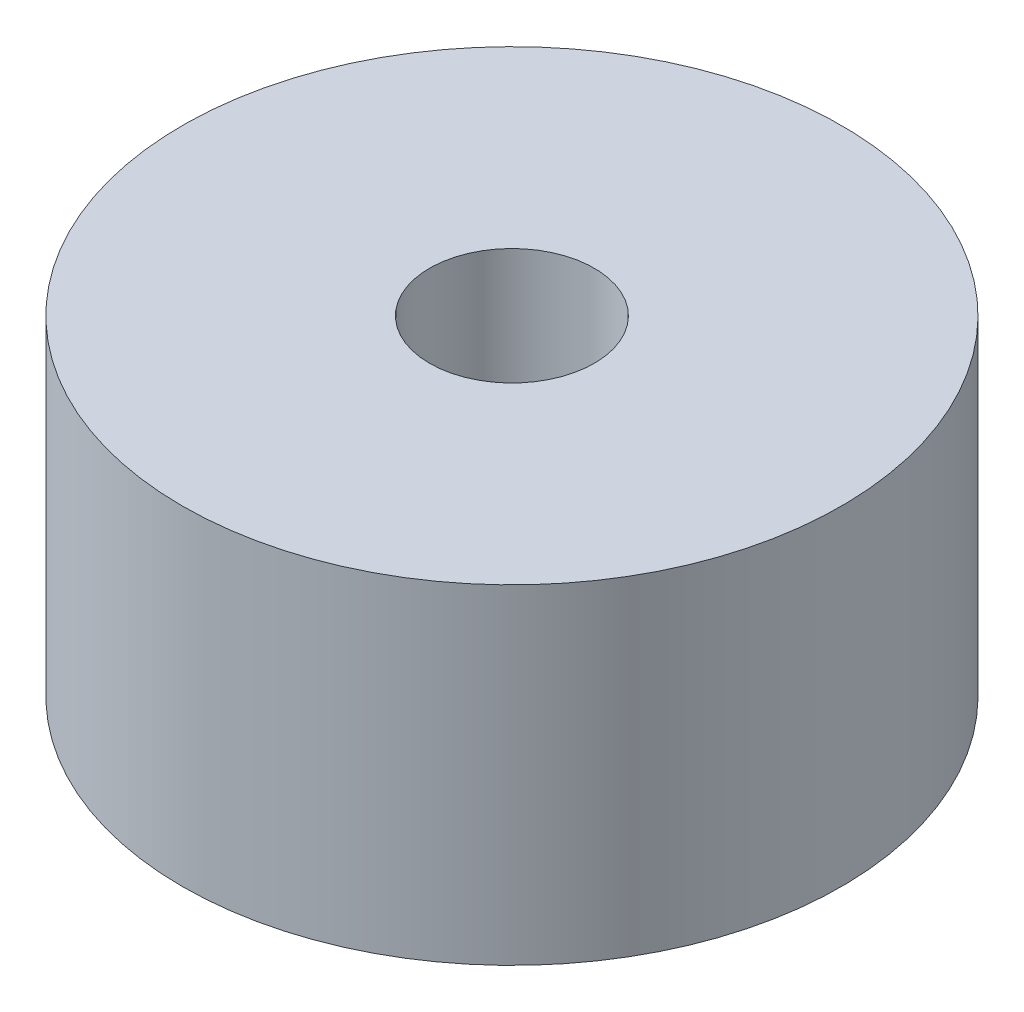
from build123d import *

# Parameters (mm, degrees)
SKETCH1_R           = 50.8
BOSS_EXTRUDE1_DEPTH = 50.8
SKETCH3_R           = 3.175
CUT_EXTRUDE1_DEPTH  = 6.35
CIRPATTERN1_COUNT   = 4
CUT_EXTRUDE2_DEPTH  = 6.35
CUT_EXTRUDE3_START  = 2.54
CUT_EXTRUDE3_DEPTH  = 2.54
CIRPATTERN2_COUNT   = 4
SKETCH6_R           = 12.7
CUT_EXTRUDE4_DEPTH  = 88.988181024


with BuildPart() as part:
    # Sketch1 → Boss-Extrude1 (new body)
    with BuildSketch(Plane(origin=(0, 0, 0), x_dir=(1, 0, 0), z_dir=(0, 1, 0))):
        with Locations(Location((0, 0, 0), (0, 0, 270))):
            Circle(SKETCH1_R)
    extrude(amount=BOSS_EXTRUDE1_DEPTH)

    # Sketch3 → Cut-Extrude1 (cut)
    with BuildSketch(Plane.XZ):
        with Locations(Location((0, 44.45, 0), (0, 0, 270))):
            Circle(SKETCH3_R)
    cut_extrude1 = extrude(amount=-CUT_EXTRUDE1_DEPTH, mode=Mode.SUBTRACT)

    # CirPattern1: Cut-Extrude1 ×4 about axis
    cirpattern1_axis = Axis((0, 0, 0), (0, 1, 0))
    for i in range(1, CIRPATTERN1_COUNT):
        add(cut_extrude1.rotate(cirpattern1_axis, i * 360 / CIRPATTERN1_COUNT), mode=Mode.SUBTRACT)

    # Sketch4 → Cut-Extrude2 (cut)
    with BuildSketch(Plane.XZ):
        with BuildLine():
            Line((43.18, -4.731127947), (43.18, -2.909935566))
            ThreePointArc((43.18, -2.909935566), (44.45, -3.175), (45.72, -2.909935566))
            Line((45.72, -2.909935566), (45.72, -4.731127947))
            ThreePointArc((45.72, -4.731127947), (44.45, -4.898619361), (43.18, -4.731127947))
        make_face()
    cut_extrude2 = extrude(amount=-CUT_EXTRUDE2_DEPTH, mode=Mode.SUBTRACT)

    # Sketch5 → Cut-Extrude3 (cut)
    with BuildSketch(Plane.XZ.offset(-6.35).offset(CUT_EXTRUDE3_START)):
        with BuildLine():
            Line((47.625, 0), (49.348619361, 0))
            ThreePointArc((49.348619361, 0), (48.337011592, -2.98120991), (45.72, -4.731127947))
            Line((45.72, -4.731127947), (45.72, -2.909935566))
            ThreePointArc((45.72, -2.909935566), (47.106395584, -1.73901912), (47.625, 0))
        make_face()
    cut_extrude3 = extrude(amount=-CUT_EXTRUDE3_DEPTH, mode=Mode.SUBTRACT)

    # CirPattern2: Cut-Extrude2, Cut-Extrude3 ×4 about axis
    cirpattern2_axis = Axis((0, 0, 0), (0, 1, 0))
    add([cut_extrude2.rotate(cirpattern2_axis, i * 360 / CIRPATTERN2_COUNT) for i in range(1, CIRPATTERN2_COUNT)], mode=Mode.SUBTRACT)
    add([cut_extrude3.rotate(cirpattern2_axis, i * 360 / CIRPATTERN2_COUNT) for i in range(1, CIRPATTERN2_COUNT)], mode=Mode.SUBTRACT)

    # Sketch6 → Cut-Extrude4 (cut, through all)
    with BuildSketch(Plane(origin=(0, 50.8, 0), x_dir=(1, 0, 0), z_dir=(0, 1, 0))):
        with Locations(Location((0, 0, 0), (0, 0, 270))):
            Circle(SKETCH6_R)
    extrude(amount=-CUT_EXTRUDE4_DEPTH, mode=Mode.SUBTRACT)


solid = part.part
